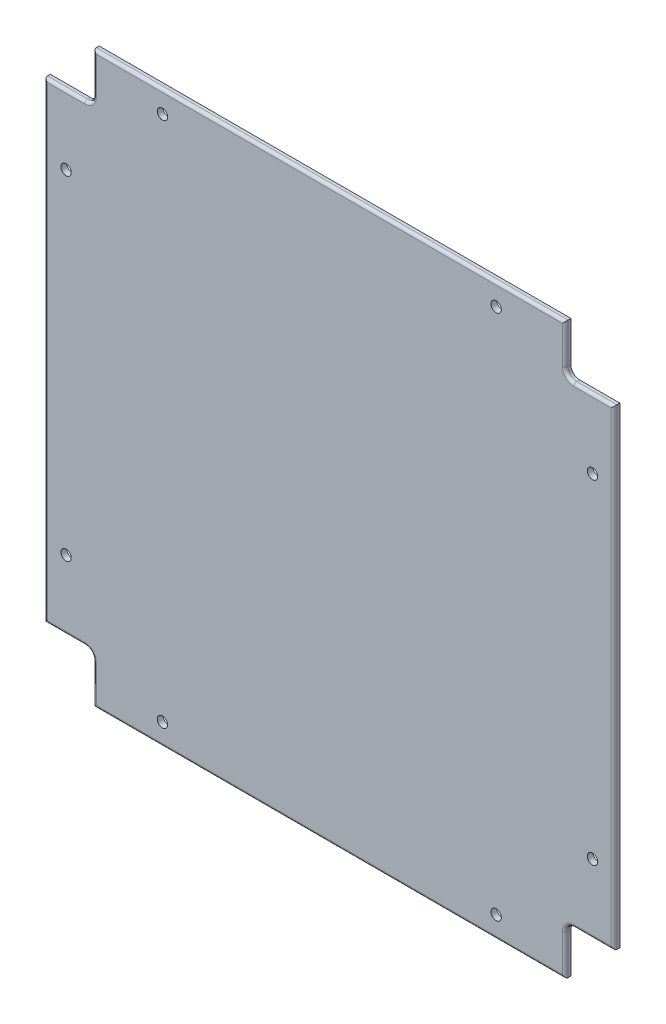
from build123d import *

# Parameters (mm, degrees)
SKETCH1_W                  = 99
SKETCH1_H                  = 99
BOSS_EXTRUDE1_DEPTH        = 0.5
CUT_EXTRUDE1_DEPTH         = 71.010713466
M1_6_CLEARANCE_HOLE1_D     = 1.8
M1_6_CLEARANCE_HOLE1_DEPTH = 3
M1_6_CLEARANCE_HOLE1_TIP   = 0.540774557
FILLET1_R                  = 0.5


with BuildPart() as part:
    # Sketch1 → Boss-Extrude1 (new, symmetric)
    with BuildSketch(Plane.XY):
        Rectangle(SKETCH1_W, SKETCH1_H)
    extrude(amount=BOSS_EXTRUDE1_DEPTH, both=True)

    # Sketch2 → Cut-Extrude1 (cut, through all)
    with BuildSketch(Plane.XY.offset(0.5)):
        with BuildLine():
            Line((-49.5, 49.5), (-41, 49.5))
            Line((-41, 49.5), (-41, 42.5))
            ThreePointArc((-41, 42.5), (-41.439339828, 41.439339828), (-42.5, 41))
            Line((-42.5, 41), (-49.5, 41))
            Line((-49.5, 41), (-49.5, 49.5))
        make_face()
        with BuildLine():
            Line((49.5, 49.5), (41, 49.5))
            Line((41, 49.5), (41, 42.5))
            ThreePointArc((41, 42.5), (41.439339828, 41.439339828), (42.5, 41))
            Line((42.5, 41), (49.5, 41))
            Line((49.5, 41), (49.5, 49.5))
        make_face()
        with BuildLine():
            Line((-49.5, -49.5), (-41, -49.5))
            Line((-41, -49.5), (-41, -42.5))
            ThreePointArc((-41, -42.5), (-41.439339828, -41.439339828), (-42.5, -41))
            Line((-42.5, -41), (-49.5, -41))
            Line((-49.5, -41), (-49.5, -49.5))
        make_face()
        with BuildLine():
            Line((49.5, -49.5), (41, -49.5))
            Line((41, -49.5), (41, -42.5))
            ThreePointArc((41, -42.5), (41.439339828, -41.439339828), (42.5, -41))
            Line((42.5, -41), (49.5, -41))
            Line((49.5, -41), (49.5, -49.5))
        make_face()
    extrude(amount=-CUT_EXTRUDE1_DEPTH, mode=Mode.SUBTRACT)

    # M1.6 Clearance Hole1
    with Locations(Plane.XY.offset(0.5)):
        with Locations((-45.75, 29), (-29, 45.75), (29, 45.75), (45.75, 29), (45.75, -29), (29, -45.75), (-29, -45.75), (-45.75, -29)):
            Hole(M1_6_CLEARANCE_HOLE1_D / 2, depth=M1_6_CLEARANCE_HOLE1_DEPTH)
            with Locations((0, 0, -(M1_6_CLEARANCE_HOLE1_DEPTH + M1_6_CLEARANCE_HOLE1_TIP / 2))):  # 118° drill point
                Cone(0, M1_6_CLEARANCE_HOLE1_D / 2, M1_6_CLEARANCE_HOLE1_TIP, mode=Mode.SUBTRACT)

    # Fillet1
    fillet1_edges = [part.edges().sort_by_distance(p)[0] for p in [
        (-49.5, 0, 0.5),
        (-46, 41, 0.5),
        (-41.439339828, 41.439339828, 0.5),
        (-41, 46, 0.5),
        (0, 49.5, 0.5),
        (41.439339828, 41.439339828, 0.5),
        (46, 41, 0.5),
        (41, 46, 0.5),
        (49.5, 0, 0.5),
        (41.439339828, -41.439339828, 0.5),
        (41, -46, 0.5),
        (46, -41, 0.5),
        (0, -49.5, 0.5),
        (-41, -46, 0.5),
        (-41.439339828, -41.439339828, 0.5),
        (-46, -41, 0.5),
    ]]
    fillet(fillet1_edges, radius=FILLET1_R)


solid = part.part
